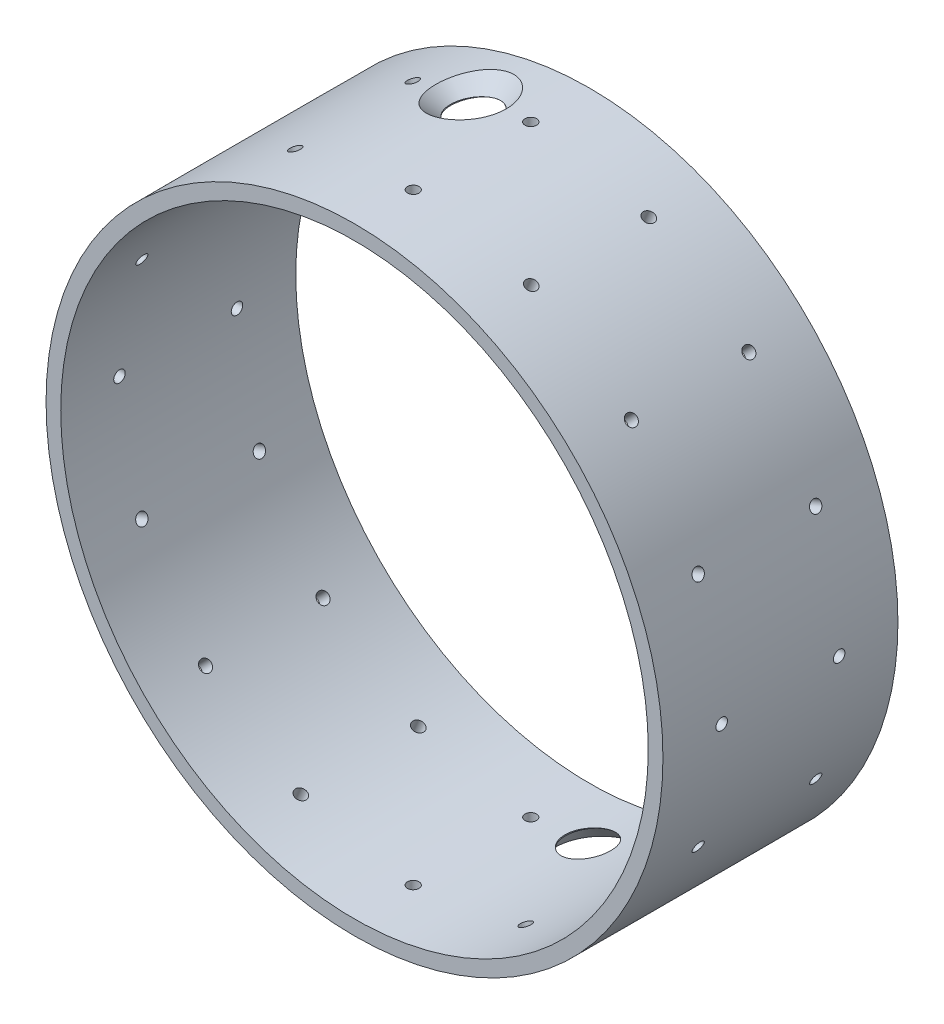
from build123d import *
from build123d.topology import SkipClean

# Parameters (mm, degrees)
SKETCH1_R                            = 66.675
SKETCH1_R_2                          = 63.5
EXTRUDE1_DEPTH                       = 50.8
F_40_0_098_DIAMETER_HOLE2_AT_2_COUNT = 2
F_40_0_098_DIAMETER_HOLE2_AT_2_PITCH = 25.4
CIRPATTERN1_COUNT                    = 16


with BuildPart() as part:
    # Sketch1 → Extrude1 (new body)
    with BuildSketch(Plane.XY):
        Circle(SKETCH1_R)
        Circle(SKETCH1_R_2, mode=Mode.SUBTRACT)
    extrude(amount=EXTRUDE1_DEPTH)

    # Sketch8 → #40 (0.098) Diameter Hole2 (revolve, cut)
    with BuildSketch(Plane(origin=(0, 66.675, 12.7), x_dir=(0, 0, 1), z_dir=(1, 0, 0))):
        Polygon((0, 0), (0, 13.447831126), (1.2446, 12.7), (1.2446, 0), align=None)
    f_40_0_098_diameter_hole2 = revolve(axis=Axis((0, 73.025, 12.7), (0, -1, 0)), mode=Mode.SUBTRACT)

    # #40 (0.098) Diameter Hole2 at 2: #40 (0.098) Diameter Hole2 ×2
    with Locations(*[(0, 0, i * F_40_0_098_DIAMETER_HOLE2_AT_2_PITCH) for i in range(1, F_40_0_098_DIAMETER_HOLE2_AT_2_COUNT)]):
        add(f_40_0_098_diameter_hole2, mode=Mode.SUBTRACT)

    # CirPattern1: #40 (0.098) Diameter Hole2 ×16 about axis
    cirpattern1_axis = Axis((0, 0, 50.8), (0, 0, -1))
    for i in range(1, CIRPATTERN1_COUNT):
        add(f_40_0_098_diameter_hole2.rotate(cirpattern1_axis, i * 360 / CIRPATTERN1_COUNT), mode=Mode.SUBTRACT)

    # CirPattern1 copy 1 sketch → CirPattern1 copy 1 (revolve, cut)
    with BuildSketch(Plane(origin=(25.515417853, 61.59966783, 38.1), x_dir=(0, 0, 1), z_dir=(0.9238795325112867, -0.3826834323650898, 0))):
        Polygon((0, 0), (0, 13.447831126), (1.2446, 12.7), (1.2446, 0), align=None)
    revolve(axis=Axis((27.945457648, 67.466302862, 38.1), (-0.3826834323650898, -0.9238795325112867, 0)), mode=Mode.SUBTRACT)

    # CirPattern1 copy 2 sketch → CirPattern1 copy 2 (revolve, cut)
    with BuildSketch(Plane(origin=(47.146344636, 47.146344636, 38.1), x_dir=(0, 0, 1), z_dir=(0.7071067811865476, -0.7071067811865475, 0))):
        Polygon((0, 0), (0, 13.447831126), (1.2446, 12.7), (1.2446, 0), align=None)
    revolve(axis=Axis((51.636472696, 51.636472696, 38.1), (-0.7071067811865475, -0.7071067811865476, 0)), mode=Mode.SUBTRACT)

    # CirPattern1 copy 3 sketch → CirPattern1 copy 3 (revolve, cut)
    with BuildSketch(Plane(origin=(61.59966783, 25.515417853, 38.1), x_dir=(0, 0, 1), z_dir=(0.38268343236508984, -0.9238795325112867, 0))):
        Polygon((0, 0), (0, 13.447831126), (1.2446, 12.7), (1.2446, 0), align=None)
    revolve(axis=Axis((67.466302862, 27.945457648, 38.1), (-0.9238795325112867, -0.38268343236508984, 0)), mode=Mode.SUBTRACT)

    # CirPattern1 copy 4 sketch → CirPattern1 copy 4 (revolve, cut)
    with BuildSketch(Plane(origin=(66.675, 0, 38.1), x_dir=(0, 0, 1), z_dir=(0, -1, 0))):
        Polygon((0, 0), (0, 13.447831126), (1.2446, 12.7), (1.2446, 0), align=None)
    revolve(axis=Axis((73.025, 0, 38.1), (-1, 0, 0)), mode=Mode.SUBTRACT)

    # CirPattern1 copy 5 sketch → CirPattern1 copy 5 (revolve, cut)
    with BuildSketch(Plane(origin=(61.59966783, -25.515417853, 38.1), x_dir=(0, 0, 1), z_dir=(-0.3826834323650897, -0.9238795325112867, 0))):
        Polygon((0, 0), (0, 13.447831126), (1.2446, 12.7), (1.2446, 0), align=None)
    revolve(axis=Axis((67.466302862, -27.945457648, 38.1), (-0.9238795325112867, 0.3826834323650897, 0)), mode=Mode.SUBTRACT)

    # CirPattern1 copy 6 sketch → CirPattern1 copy 6 (revolve, cut)
    with BuildSketch(Plane(origin=(47.146344636, -47.146344636, 38.1), x_dir=(0, 0, 1), z_dir=(-0.7071067811865475, -0.7071067811865476, 0))):
        Polygon((0, 0), (0, 13.447831126), (1.2446, 12.7), (1.2446, 0), align=None)
    revolve(axis=Axis((51.636472696, -51.636472696, 38.1), (-0.7071067811865476, 0.7071067811865475, 0)), mode=Mode.SUBTRACT)

    # CirPattern1 copy 7 sketch → CirPattern1 copy 7 (revolve, cut)
    with BuildSketch(Plane(origin=(25.515417853, -61.59966783, 38.1), x_dir=(0, 0, 1), z_dir=(-0.9238795325112867, -0.3826834323650899, 0))):
        Polygon((0, 0), (0, 13.447831126), (1.2446, 12.7), (1.2446, 0), align=None)
    revolve(axis=Axis((27.945457648, -67.466302862, 38.1), (-0.3826834323650899, 0.9238795325112867, 0)), mode=Mode.SUBTRACT)

    # CirPattern1 copy 8 sketch → CirPattern1 copy 8 (revolve, cut)
    with BuildSketch(Plane(origin=(0, -66.675, 38.1), x_dir=(0, 0, 1), z_dir=(-1, 0, 0))):
        Polygon((0, 0), (0, 13.447831126), (1.2446, 12.7), (1.2446, 0), align=None)
    revolve(axis=Axis((0, -73.025, 38.1), (0, 1, 0)), mode=Mode.SUBTRACT)

    # CirPattern1 copy 9 sketch → CirPattern1 copy 9 (revolve, cut)
    with BuildSketch(Plane(origin=(-25.515417853, -61.59966783, 38.1), x_dir=(0, 0, 1), z_dir=(-0.9238795325112868, 0.38268343236508967, 0))):
        Polygon((0, 0), (0, 13.447831126), (1.2446, 12.7), (1.2446, 0), align=None)
    revolve(axis=Axis((-27.945457648, -67.466302862, 38.1), (0.38268343236508967, 0.9238795325112868, 0)), mode=Mode.SUBTRACT)

    # CirPattern1 copy 10 sketch → CirPattern1 copy 10 (revolve, cut)
    with BuildSketch(Plane(origin=(-47.146344636, -47.146344636, 38.1), x_dir=(0, 0, 1), z_dir=(-0.7071067811865477, 0.7071067811865475, 0))):
        Polygon((0, 0), (0, 13.447831126), (1.2446, 12.7), (1.2446, 0), align=None)
    revolve(axis=Axis((-51.636472696, -51.636472696, 38.1), (0.7071067811865475, 0.7071067811865477, 0)), mode=Mode.SUBTRACT)

    # CirPattern1 copy 11 sketch → CirPattern1 copy 11 (revolve, cut)
    with BuildSketch(Plane(origin=(-61.59966783, -25.515417853, 38.1), x_dir=(0, 0, 1), z_dir=(-0.3826834323650895, 0.9238795325112868, 0))):
        Polygon((0, 0), (0, 13.447831126), (1.2446, 12.7), (1.2446, 0), align=None)
    revolve(axis=Axis((-67.466302862, -27.945457648, 38.1), (0.9238795325112868, 0.3826834323650895, 0)), mode=Mode.SUBTRACT)

    # CirPattern1 copy 12 sketch → CirPattern1 copy 12 (revolve, cut)
    with BuildSketch(Plane(origin=(-66.675, 0, 38.1), x_dir=(0, 0, 1), z_dir=(0, 1, 0))):
        Polygon((0, 0), (0, 13.447831126), (1.2446, 12.7), (1.2446, 0), align=None)
    revolve(axis=Axis((-73.025, 0, 38.1), (1, 0, 0)), mode=Mode.SUBTRACT)

    # CirPattern1 copy 13 sketch → CirPattern1 copy 13 (revolve, cut)
    with BuildSketch(Plane(origin=(-61.59966783, 25.515417853, 38.1), x_dir=(0, 0, 1), z_dir=(0.38268343236509, 0.9238795325112866, 0))):
        Polygon((0, 0), (0, 13.447831126), (1.2446, 12.7), (1.2446, 0), align=None)
    revolve(axis=Axis((-67.466302862, 27.945457648, 38.1), (0.9238795325112866, -0.38268343236509, 0)), mode=Mode.SUBTRACT)

    # CirPattern1 copy 14 sketch → CirPattern1 copy 14 (revolve, cut)
    with BuildSketch(Plane(origin=(-47.146344636, 47.146344636, 38.1), x_dir=(0, 0, 1), z_dir=(0.7071067811865474, 0.7071067811865477, 0))):
        Polygon((0, 0), (0, 13.447831126), (1.2446, 12.7), (1.2446, 0), align=None)
    revolve(axis=Axis((-51.636472696, 51.636472696, 38.1), (0.7071067811865477, -0.7071067811865474, 0)), mode=Mode.SUBTRACT)

    # CirPattern1 copy 15 sketch → CirPattern1 copy 15 (revolve, cut)
    with BuildSketch(Plane(origin=(-25.515417853, 61.59966783, 38.1), x_dir=(0, 0, 1), z_dir=(0.9238795325112868, 0.38268343236508956, 0))):
        Polygon((0, 0), (0, 13.447831126), (1.2446, 12.7), (1.2446, 0), align=None)
    revolve(axis=Axis((-27.945457648, 67.466302862, 38.1), (0.38268343236508956, -0.9238795325112868, 0)), mode=Mode.SUBTRACT)

    # Sketch14 → 3/8 Clearance Hole1 (revolve, cut)
    with SkipClean():  # the faces are left unmerged after this step: merging them gives an invalid solid
        with BuildSketch(Plane(origin=(-13.00764722, 65.393858571, 12.7), x_dir=(-0.9807852804032303, -0.19509032201612872, 0), z_dir=(0, 0, 1))):
            Polygon((0, 0), (0, 15.983479155), (5.0419, 12.954), (5.0419, 3.175), (8.2169, 0), align=None)
        f_3_8_clearance_hole1 = revolve(axis=Axis((-14.246470765, 71.621845101, 12.7), (0.19509032201612872, -0.9807852804032303, 0)), mode=Mode.SUBTRACT)

    # Mirror1: 3/8 Clearance Hole1 across plane
    with SkipClean():  # the faces are left unmerged after this step: merging them gives an invalid solid
        add(f_3_8_clearance_hole1.mirror(Plane(origin=(0, 0, 12.7), x_dir=(0, 0, 1), z_dir=(-0.19509032201612872, 0.9807852804032303, 0))), mode=Mode.SUBTRACT)


solid = part.part
